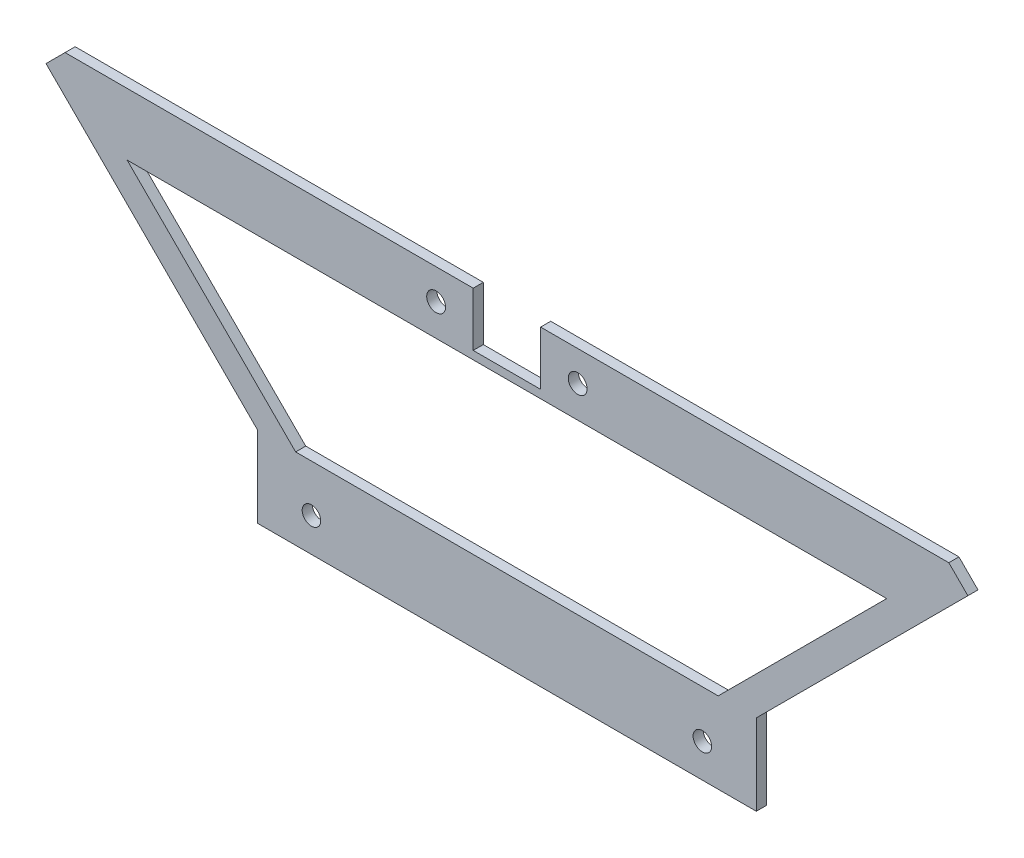
from build123d import *

# Parameters (mm, degrees)
SKETCH1_R           = 1.375
SKETCH1_R_2         = 1.4
BOSS_EXTRUDE1_DEPTH = 1.5


with BuildPart() as part:
    # Sketch1 → Boss-Extrude1 (new body)
    # profile 1 of 2: a face of its own
    with BuildSketch(Plane.XY):
        Polygon((37, 12), (37, 0), (-37, 0), (-37, 12), (-68.380126203, 43.380126203), (-65.551699078, 46.208553328), (-31.343145751, 12), (31.343145751, 12), (65.562445841, 46.21930009), (68.390872965, 43.390872965), align=None)
        with Locations((29, 5)):
            Circle(SKETCH1_R, mode=Mode.SUBTRACT)
        with Locations((-29, 5)):
            Circle(SKETCH1_R, mode=Mode.SUBTRACT)
    # profile 2 of 2: a face of its own
    with BuildSketch(Plane.XY):
        Polygon((-5, 46.213516444), (-65.551699078, 46.208553328), (-56.343145751, 37), (56.343145751, 37), (65.562445841, 46.21930009), (5, 46.214336093), (5, 38.213516444), (-5, 38.213516444), align=None)
        with Locations((-10.5, 41.713065622)):
            Circle(SKETCH1_R_2, mode=Mode.SUBTRACT)
        with Locations((10.499999929, 41.714786885)):
            Circle(SKETCH1_R_2, mode=Mode.SUBTRACT)
    extrude(amount=BOSS_EXTRUDE1_DEPTH)


solid = part.part
